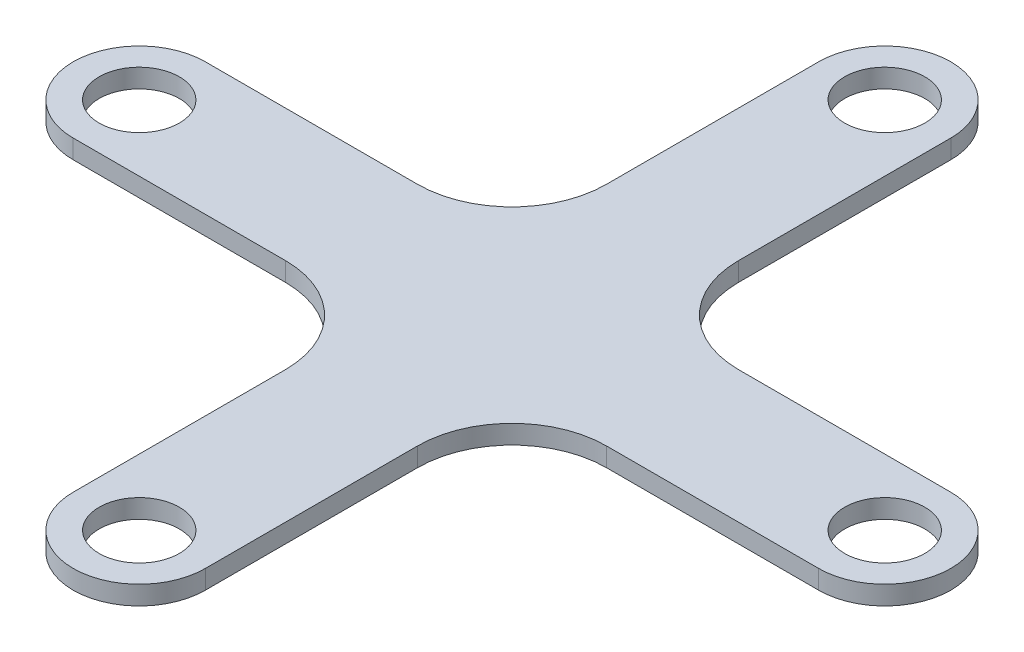
from build123d import *

# Parameters (mm, degrees)
SKETCH1_R           = 4.25
BOSS_EXTRUDE1_DEPTH = 2


with BuildPart() as part:
    # Sketch1 → Boss-Extrude1 (new body)
    with BuildSketch(Plane(origin=(0, 0, 0), x_dir=(1, 0, 0), z_dir=(0, 1, 0))):
        with BuildLine():
            Line((-39.5, 7), (-17, 7))
            ThreePointArc((-17, 7), (-9.928932188, 9.928932188), (-7, 17))
            Line((-7, 17), (-7, 39.5))
            ThreePointArc((-7, 39.5), (0, 46.5), (7, 39.5))
            Line((7, 39.5), (7, 17))
            ThreePointArc((7, 17), (9.928932188, 9.928932188), (17, 7))
            Line((17, 7), (39.5, 7))
            ThreePointArc((39.5, 7), (46.5, 0), (39.5, -7))
            Line((39.5, -7), (17, -7))
            ThreePointArc((17, -7), (9.928932188, -9.928932188), (7, -17))
            Line((7, -17), (7, -39.5))
            ThreePointArc((7, -39.5), (0, -46.5), (-7, -39.5))
            Line((-7, -39.5), (-7, -17))
            ThreePointArc((-7, -17), (-9.928932188, -9.928932188), (-17, -7))
            Line((-17, -7), (-39.5, -7))
            ThreePointArc((-39.5, -7), (-46.5, 0), (-39.5, 7))
        make_face()
        with Locations(Location((0, 39.5, 0), (0, 0, 270))):
            Circle(SKETCH1_R, mode=Mode.SUBTRACT)
        with Locations(Location((39.5, 0, 0), (0, 0, 270))):
            Circle(SKETCH1_R, mode=Mode.SUBTRACT)
        with Locations(Location((0, -39.5, 0), (0, 0, 270))):
            Circle(SKETCH1_R, mode=Mode.SUBTRACT)
        with Locations(Location((-39.5, 0, 0), (0, 0, 270))):
            Circle(SKETCH1_R, mode=Mode.SUBTRACT)
    extrude(amount=BOSS_EXTRUDE1_DEPTH)


solid = part.part
